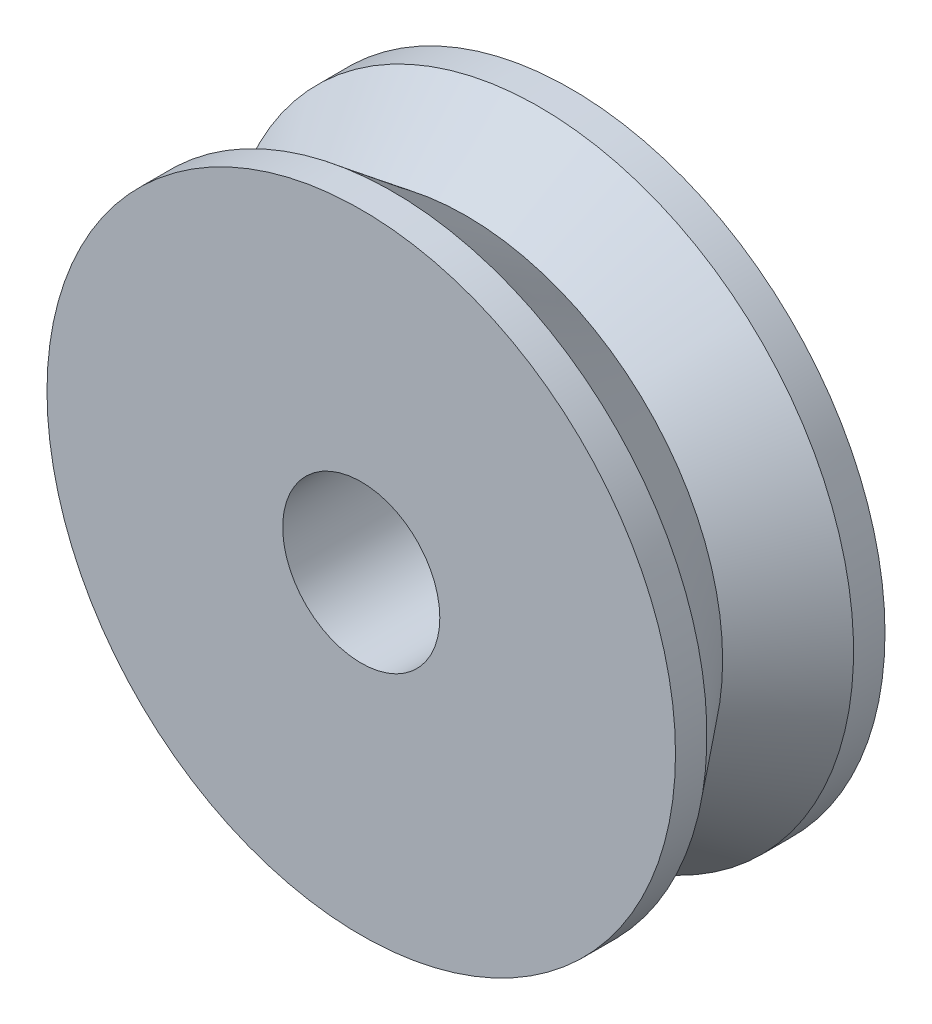
from build123d import *

# Parameters (mm, degrees)
SKETCH_1_R      = 6
SKETCH_1_R_2    = 1.5
EXTRUDE_1_DEPTH = 4


with BuildPart() as part:
    # 草图1 → 凸台-拉伸1 (new body)
    with BuildSketch(Plane.XY):
        Circle(SKETCH_1_R)
        Circle(SKETCH_1_R_2, mode=Mode.SUBTRACT)
    extrude(amount=EXTRUDE_1_DEPTH)

    # 草图2 → 切除-旋转1 (revolve, cut)
    with BuildSketch(Plane(origin=(0, 0, 0), x_dir=(0, 0, -1), z_dir=(1, 0, 0)), mode=Mode.PRIVATE) as cut_revolve_1_sk:
        Polygon((-3.4, 6), (-2, 4.9), (-0.6, 6), align=None)
    revolve(cut_revolve_1_sk.sketch.rotate(Axis((0, 0, 0), (0, 0, 1)), 90), axis=Axis((0, 0, 0), (0, 0, 1)), mode=Mode.SUBTRACT)


solid = part.part
